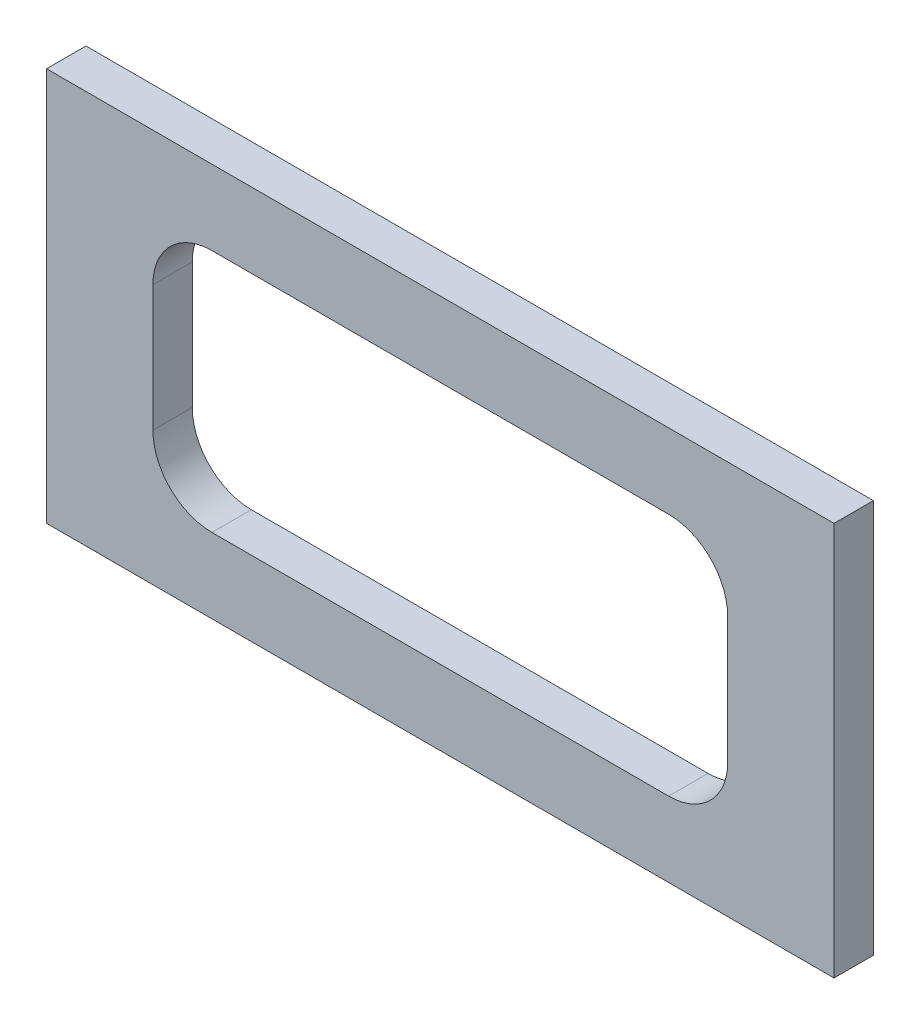
from build123d import *

# Parameters (mm, degrees)
SKETCH1_W           = 100
SKETCH1_H           = 50
BOSS_EXTRUDE1_DEPTH = 5
CUT_EXTRUDE1_DEPTH  = 5


with BuildPart() as part:
    # Sketch1 → Boss-Extrude1 (new body)
    with BuildSketch(Plane.XY):
        with Locations((50, 25)):
            Rectangle(SKETCH1_W, SKETCH1_H)
    extrude(amount=BOSS_EXTRUDE1_DEPTH)

    # Sketch2 → Cut-Extrude1 (cut)
    with BuildSketch(Plane.XY.offset(5)):
        with BuildLine():
            Line((21, 40.5), (79, 40.5))
            ThreePointArc((79, 40.5), (84.303300859, 38.303300859), (86.5, 33))
            Line((86.5, 33), (86.5, 17))
            ThreePointArc((86.5, 17), (84.303300859, 11.696699141), (79, 9.5))
            Line((79, 9.5), (21, 9.5))
            ThreePointArc((21, 9.5), (15.696699141, 11.696699141), (13.5, 17))
            Line((13.5, 17), (13.5, 33))
            ThreePointArc((13.5, 33), (15.696699141, 38.303300859), (21, 40.5))
        make_face()
    extrude(amount=-CUT_EXTRUDE1_DEPTH, mode=Mode.SUBTRACT)


solid = part.part
